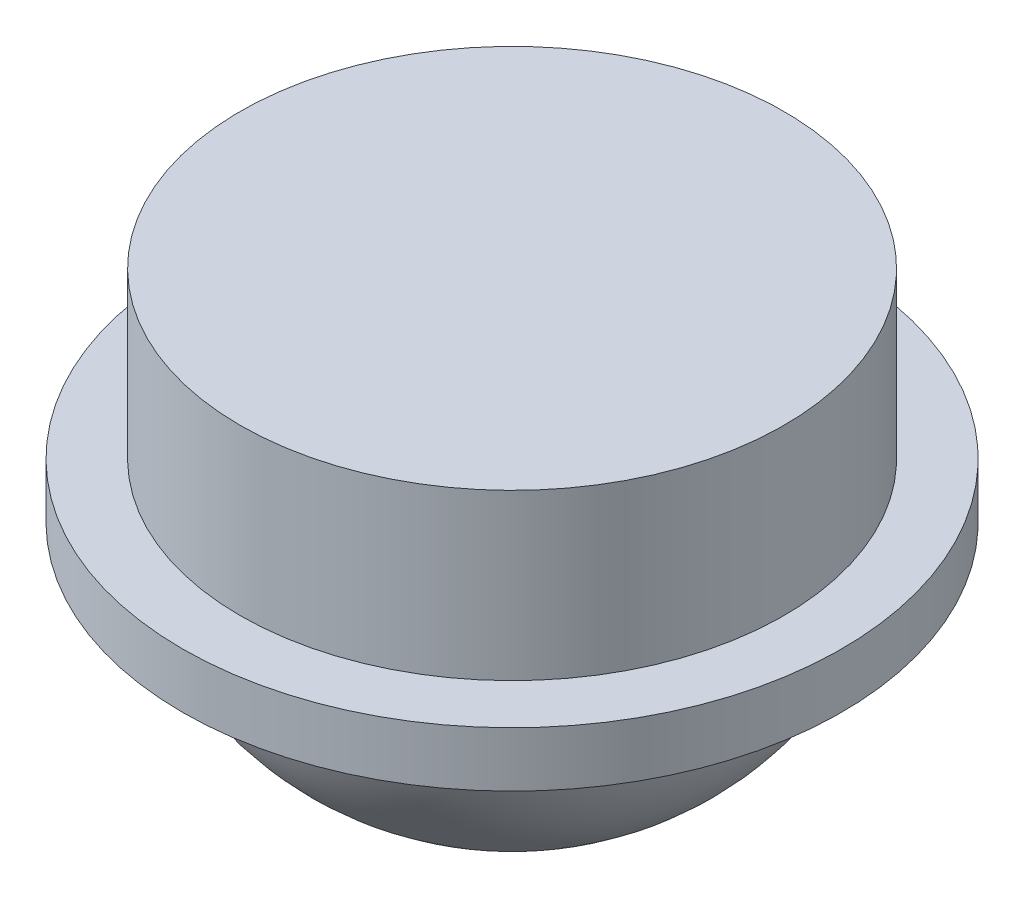
from build123d import *


with BuildPart() as part:
    # Sketch1 → Revolve1 (revolve)
    with BuildSketch(Plane(origin=(0, 0, -44.1), x_dir=(-1, 0, 0), z_dir=(0, 0, -1)), mode=Mode.PRIVATE) as revolve1_sk:
        with BuildLine():
            Line((-60.101021409, -23.2), (-60.000000894, -23.2))
            Line((-60.000000894, -23.2), (-60.000000894, -15.2))
            Line((-60.000000894, -15.2), (-64.950000894, -15.2))
            Line((-64.950000894, -15.2), (-64.950000894, -18.2))
            Line((-64.950000894, -18.2), (-66.000000894, -18.2))
            Line((-66.000000894, -18.2), (-66.000000894, -19.2))
            Line((-66.000000894, -19.2), (-65.000000894, -19.2))
            ThreePointArc((-65.000000894, -19.2), (-63.263299069, -22.072983346), (-60.101021409, -23.2))
        make_face()
    revolve(revolve1_sk.sketch.rotate(Axis((60.000000894, -23.2, -44.1), (0, 1, 0)), 270), axis=Axis((60.000000894, -23.2, -44.1), (0, 1, 0)))


solid = part.part
